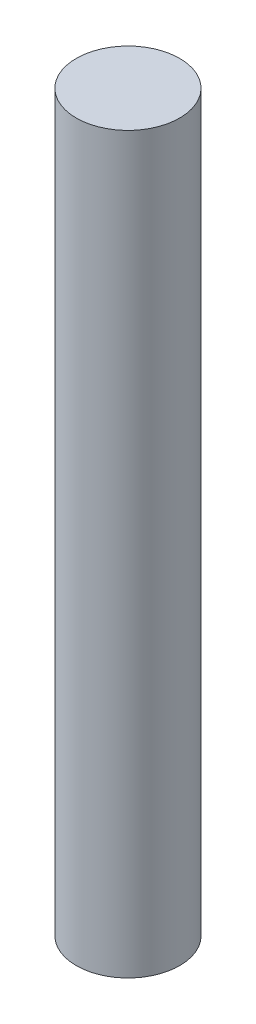
from build123d import *

# Parameters (mm, degrees)
SKETCH1_R           = 0.5
BOSS_EXTRUDE1_DEPTH = 7.1


with BuildPart() as part:
    # Sketch1 → Boss-Extrude1 (new body)
    with BuildSketch(Plane(origin=(0, 0, 0), x_dir=(1, 0, 0), z_dir=(0, 1, 0))):
        with Locations(Location((0, 0, 0), (0, 0, 270))):
            Circle(SKETCH1_R)
    extrude(amount=BOSS_EXTRUDE1_DEPTH)


solid = part.part
